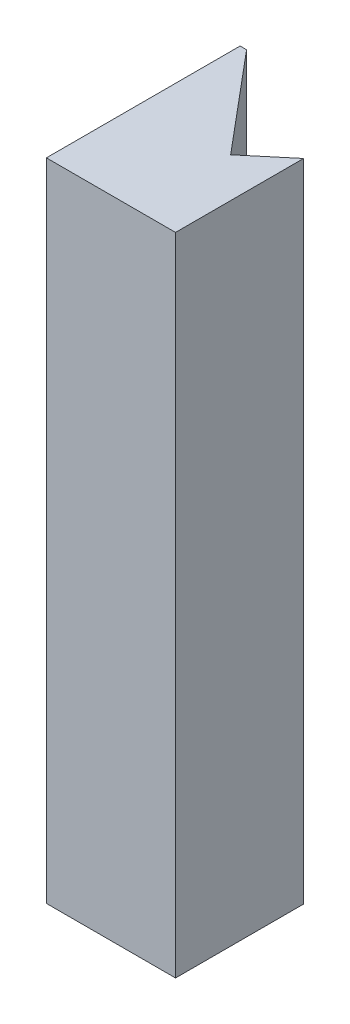
from build123d import *

# Parameters (mm, degrees)
BOSS_EXTRUDE1_DEPTH = 127


with BuildPart() as part:
    # Sketch1 → Boss-Extrude1 (new body)
    with BuildSketch(Plane(origin=(0, 0, 0), x_dir=(1, 0, 0), z_dir=(0, 1, 0))):
        Polygon((-26.059279302, 36.213233296), (-9.732474016, 16.75570444), (-1.929279302, 23.303362247), (-1.929279302, -1.886766704), (-27.329279302, -1.886766704), (-27.329279302, 36.213233296), align=None)
    extrude(amount=BOSS_EXTRUDE1_DEPTH)


solid = part.part
